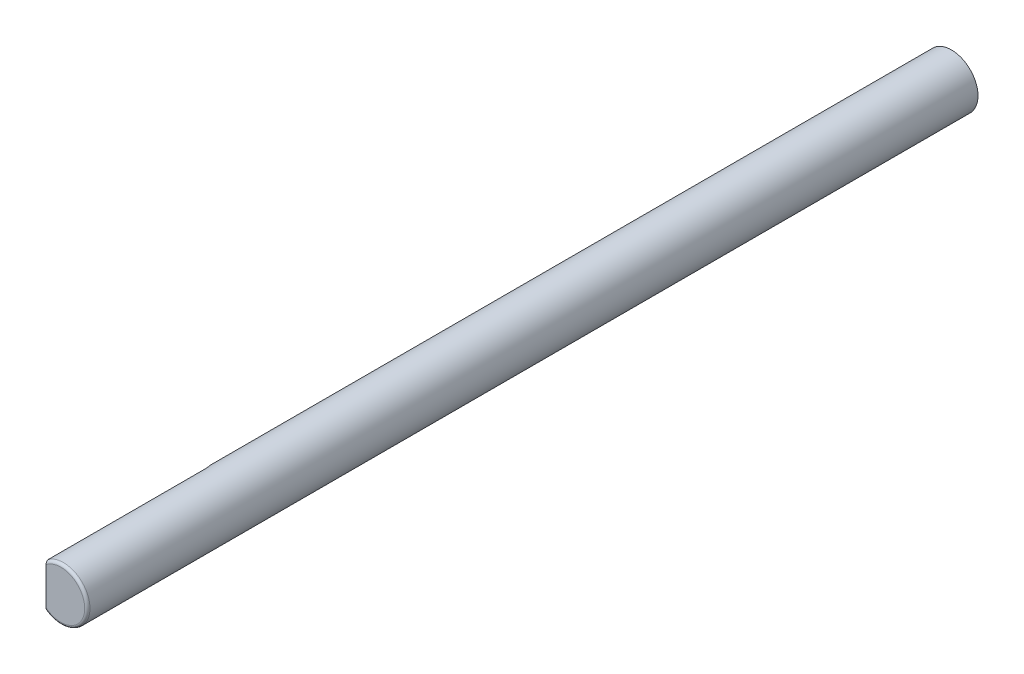
from build123d import *

# Parameters (mm, degrees)
SKETCH1_R               = 2.5
EXTRUDE1_DEPTH          = 84
FILLET1_R               = 0.25
CUT_EXTRUDE1_DEPTH      = 3
CUT_EXTRUDE1_DEPTH_BACK = 3


with BuildPart() as part:
    # Sketch1 → Extrude1 (new body)
    with BuildSketch(Plane.XY):
        Circle(SKETCH1_R)
    extrude(amount=EXTRUDE1_DEPTH)

    # Fillet1
    fillet1_edges = [part.edges().sort_by_distance(p)[0] for p in [
        (-2.5, 0, 84),
    ]]
    fillet(fillet1_edges, radius=FILLET1_R)

    # Sketch2 → Cut-Extrude1 (cut, two sides: drawn at the far end of the back side and taken through both)
    with BuildSketch(Plane(origin=(0, 0, 0), x_dir=(1, 0, 0), z_dir=(0, 1, 0)).offset(-CUT_EXTRUDE1_DEPTH_BACK)):
        with BuildLine():
            Line((-1.4, -84), (-1.4, -69))
            ThreePointArc((-1.4, -69), (-1.806967498, -68.194821478), (-2.696624903, -68.045005934))
            Line((-2.696624903, -68.045005934), (-2.696624903, -84))
            Line((-2.696624903, -84), (-1.4, -84))
        make_face()
    extrude(amount=CUT_EXTRUDE1_DEPTH + CUT_EXTRUDE1_DEPTH_BACK, mode=Mode.SUBTRACT)


solid = part.part
